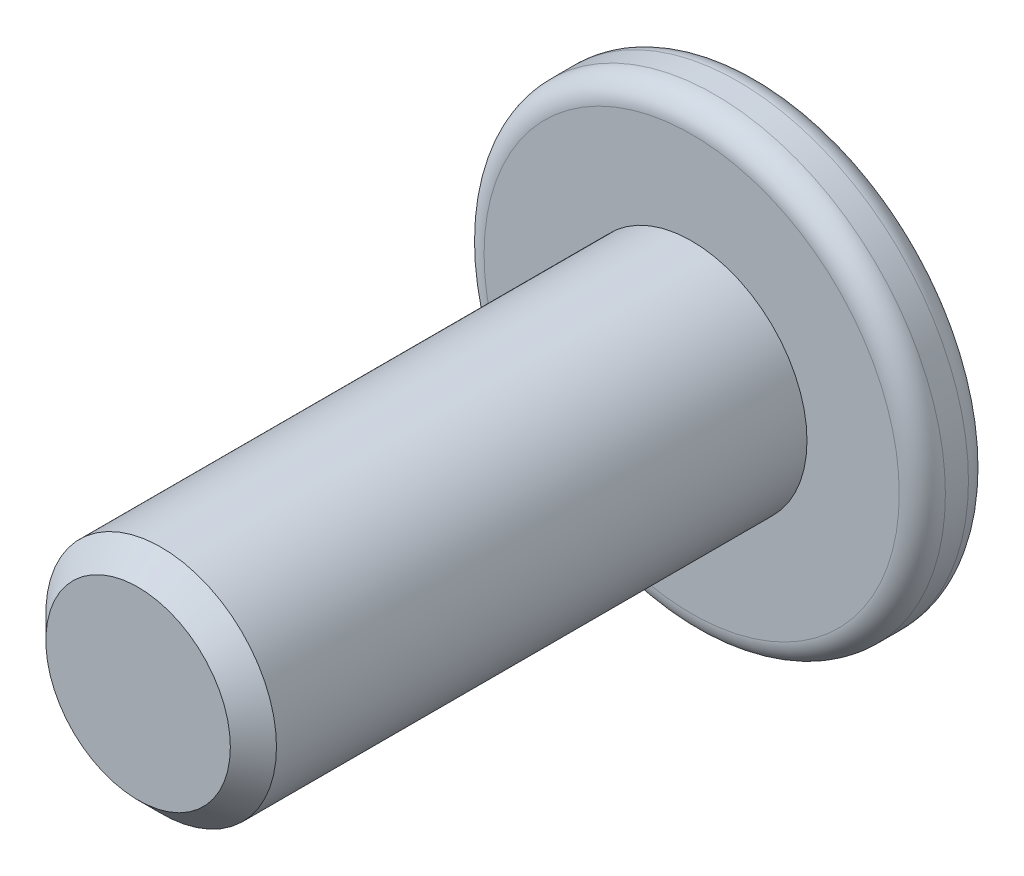
from build123d import *

# Parameters (mm, degrees)
SKETCH1_R           = 10
BOSS_EXTRUDE1_DEPTH = 3
SKETCH1_3_R         = 5
BOSS_EXTRUDE2_DEPTH = 27
CHAMFER1_SIZE       = 1
FILLET1_R           = 1


with BuildPart() as part:
    # Sketch1 → Boss-Extrude1 (new body)
    with BuildSketch(Plane.XY):
        Circle(SKETCH1_R)
    extrude(amount=BOSS_EXTRUDE1_DEPTH)

    # Sketch1<3> → Boss-Extrude2 (add)
    with BuildSketch(Plane.XY):
        Circle(SKETCH1_3_R)
    extrude(amount=BOSS_EXTRUDE2_DEPTH)

    # Chamfer1
    chamfer1_edges = [part.edges().sort_by_distance(p)[0] for p in [
        (-5, 0, 27),
    ]]
    chamfer(chamfer1_edges, length=CHAMFER1_SIZE)

    # Fillet1
    fillet1_edges = [part.edges().sort_by_distance(p)[0] for p in [
        (-10, 0, 3),
        (-10, 0, 0),
    ]]
    fillet(fillet1_edges, radius=FILLET1_R)


solid = part.part
